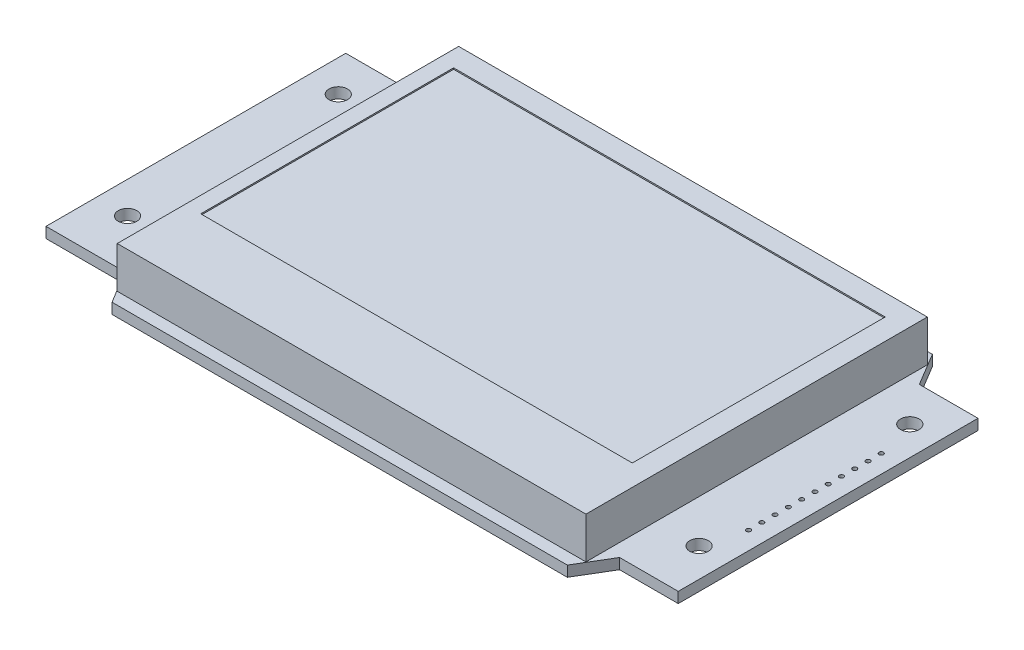
from build123d import *

# Parameters (mm, degrees)
BOSS_EXTRUDE1_DEPTH = 1.6
SKETCH2_R           = 1.397
CUT_EXTRUDE1_DEPTH  = 67.676798076
SKETCH3_W           = 70.612
SKETCH3_H           = 51.435
BOSS_EXTRUDE2_DEPTH = 6.2357
SKETCH4_W           = 65.024
SKETCH4_H           = 38.1
CUT_EXTRUDE2_DEPTH  = 0.2
SKETCH5_R           = 0.3302
CUT_EXTRUDE3_DEPTH  = 67.94863222
LPATTERN1_COUNT     = 11
LPATTERN1_PITCH     = 2


with BuildPart() as part:
    # Sketch1 → Boss-Extrude1 (new body)
    with BuildSketch(Plane(origin=(0, 0, 0), x_dir=(1, 0, 0), z_dir=(0, 1, 0))):
        Polygon((-60.059561589, 21.169974834), (-60.059561589, -23.991225166), (-48.223161589, -23.991225166), (-45.175161589, -28.915125166), (23.404838411, -28.915125166), (26.351238411, -23.991225166), (35.190438411, -23.991225166), (35.190438411, 21.169974834), (26.351238411, 21.169974834), (23.404838411, 26.084874834), (-45.175161589, 26.084874834), (-48.223161589, 21.169974834), align=None)
    extrude(amount=BOSS_EXTRUDE1_DEPTH)

    # Sketch2 → Cut-Extrude1 (cut, through all)
    with BuildSketch(Plane(origin=(0, 1.6, 0), x_dir=(1, 0, 0), z_dir=(0, 1, 0))):
        with Locations(Location((-55.271661589, 15.251774834, 0), (0, 0, 270))):
            Circle(SKETCH2_R)
        with Locations(Location((-55.271661589, -16.498225166, 0), (0, 0, 270))):
            Circle(SKETCH2_R)
        with Locations(Location((30.834338411, -16.498225166, 0), (0, 0, 270))):
            Circle(SKETCH2_R)
        with Locations(Location((30.834338411, 15.251774834, 0), (0, 0, 270))):
            Circle(SKETCH2_R)
    extrude(amount=-CUT_EXTRUDE1_DEPTH, mode=Mode.SUBTRACT)

    # Sketch3 → Boss-Extrude2 (add)
    with BuildSketch(Plane(origin=(0, 1.6, 0), x_dir=(1, 0, 0), z_dir=(0, 1, 0))):
        with Locations((-10.910561589, -1.382625166)):
            Rectangle(SKETCH3_W, SKETCH3_H)
    extrude(amount=BOSS_EXTRUDE2_DEPTH)

    # Sketch4 → Cut-Extrude2 (cut)
    with BuildSketch(Plane(origin=(0, 7.8357, 0), x_dir=(1, 0, 0), z_dir=(0, 1, 0))):
        with Locations((-11.291561589, 2.109874834)):
            Rectangle(SKETCH4_W, SKETCH4_H)
    extrude(amount=-CUT_EXTRUDE2_DEPTH, mode=Mode.SUBTRACT)

    # Sketch5 → Cut-Extrude3 (cut, through all)
    with BuildSketch(Plane(origin=(0, 1.6, 0), x_dir=(1, 0, 0), z_dir=(0, 1, 0))):
        with Locations(Location((32.490438411, 9.299974834, 0), (0, 0, 270))):
            Circle(SKETCH5_R)
    cut_extrude3 = extrude(amount=-CUT_EXTRUDE3_DEPTH, mode=Mode.SUBTRACT)

    # LPattern1: Cut-Extrude3 ×11
    with Locations(*[(0, 0, i * LPATTERN1_PITCH) for i in range(1, LPATTERN1_COUNT)]):
        add(cut_extrude3, mode=Mode.SUBTRACT)


solid = part.part
